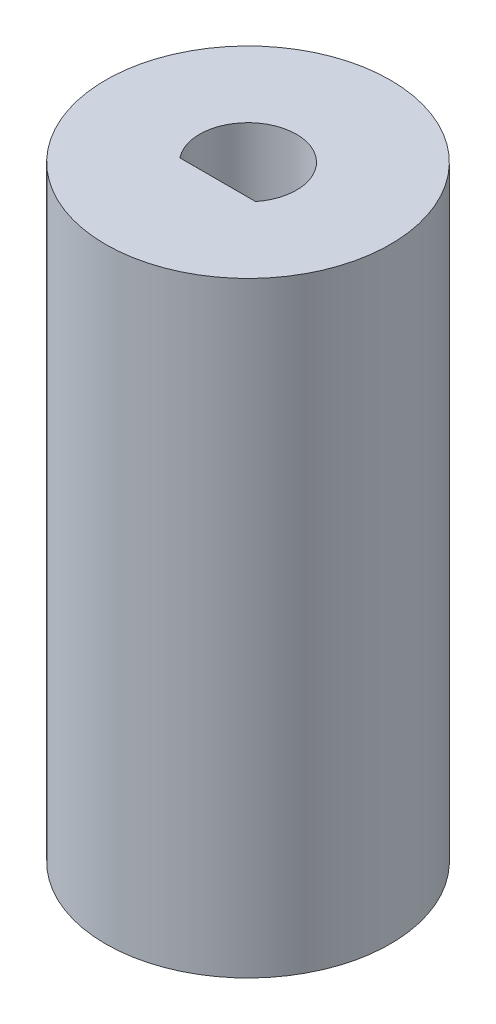
from build123d import *

# Parameters (mm, degrees)
SKETCH1_W          = 3.5
SKETCH1_H          = 20
SKETCH1_W_2        = 0.351227394
SKETCH1_H_2        = 9.140463919
SKETCH3_R          = 0.848772606
CUT_EXTRUDE1_DEPTH = 8


with BuildPart() as part:
    # Sketch1 → Revolve1 (revolve)
    with BuildSketch(Plane.XY, mode=Mode.PRIVATE) as revolve1_sk:
        with Locations((-2.95, 10)):
            Rectangle(SKETCH1_W, SKETCH1_H)
        with Locations((-1.024386303, 15.429768041)):
            Rectangle(SKETCH1_W_2, SKETCH1_H_2)
    revolve(revolve1_sk.sketch.rotate(Axis((0, 0, 0), (0, 1, 0)), 270), axis=Axis((0, 0, 0), (0, 1, 0)))

    # Sketch3 → Cut-Extrude1 (cut)
    # profile 1 of 5: a face of its own
    with BuildSketch(Plane(origin=(0, 20, 0), x_dir=(1, 0, 0), z_dir=(0, 1, 0))):
        with BuildLine():
            Line((0.452879675, 1.43), (-0.452879675, 1.43))
            ThreePointArc((-0.452879675, 1.43), (-1.428365431, 0.458008946), (-1.2, -0.9))
            Line((-1.2, -0.9), (1.2, -0.9))
            ThreePointArc((1.2, -0.9), (1.428365431, 0.458008946), (0.452879675, 1.43))
        make_face()
        with Locations(Location((0, 0, 0), (0, 0, 90))):
            Circle(SKETCH3_R, mode=Mode.SUBTRACT)
    # profile 2 of 5: a face of its own
    with BuildSketch(Plane(origin=(0, 20, 0), x_dir=(1, 0, 0), z_dir=(0, 1, 0))):
        with BuildLine():
            ThreePointArc((0.452879675, 1.43), (0, 1.5), (-0.452879675, 1.43))
            Line((-0.452879675, 1.43), (0.452879675, 1.43))
        make_face()
    # profile 3 of 5: a face of its own
    with BuildSketch(Plane(origin=(0, 20, 0), x_dir=(1, 0, 0), z_dir=(0, 1, 0))):
        with BuildLine():
            ThreePointArc((0.717704675, 1.43), (0, 1.6), (-0.717704675, 1.43))
            Line((-0.717704675, 1.43), (-0.452879675, 1.43))
            ThreePointArc((-0.452879675, 1.43), (0, 1.5), (0.452879675, 1.43))
            Line((0.452879675, 1.43), (0.717704675, 1.43))
        make_face()
    # profile 4 of 5: a face of its own
    with BuildSketch(Plane(origin=(0, 20, 0), x_dir=(1, 0, 0), z_dir=(0, 1, 0))):
        with BuildLine():
            ThreePointArc((-0.717704675, 1.43), (-1.56307595, 0.341750749), (-1.2489996, -1))
            Line((-1.2489996, -1), (1.2489996, -1))
            ThreePointArc((1.2489996, -1), (1.56307595, 0.341750749), (0.717704675, 1.43))
            Line((0.717704675, 1.43), (0.452879675, 1.43))
            ThreePointArc((0.452879675, 1.43), (1.428365431, 0.458008946), (1.2, -0.9))
            Line((1.2, -0.9), (-1.2, -0.9))
            ThreePointArc((-1.2, -0.9), (-1.428365431, 0.458008946), (-0.452879675, 1.43))
            Line((-0.452879675, 1.43), (-0.717704675, 1.43))
        make_face()
    # profile 5 of 5: a face of its own
    with BuildSketch(Plane(origin=(0, 20, 0), x_dir=(1, 0, 0), z_dir=(0, 1, 0))):
        with Locations(Location((0, 0, 0), (0, 0, 90))):
            Circle(SKETCH3_R)
    extrude(amount=-CUT_EXTRUDE1_DEPTH, mode=Mode.SUBTRACT)


solid = part.part
